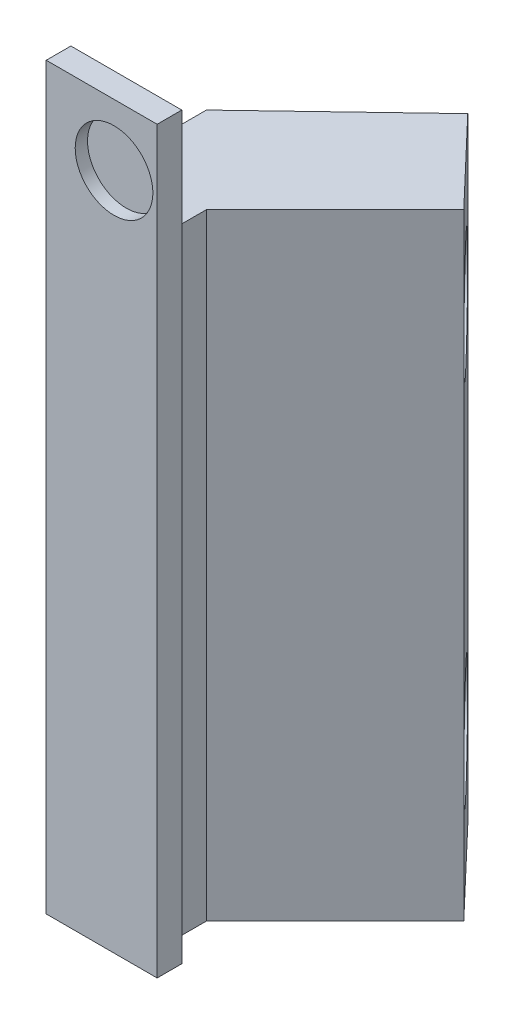
from build123d import *

# Parameters (mm, degrees)
BOSS_EXTRUDE1_DEPTH = 50
BOSS_EXTRUDE2_DEPTH = 10
SKETCH3_R           = 3.15
CUT_EXTRUDE1_DEPTH  = 1
BOSS_EXTRUDE3_DEPTH = 50
SKETCH5_W           = 5
SKETCH5_H           = 2
BOSS_EXTRUDE4_DEPTH = 1
SKETCH6_R           = 2.5
CUT_EXTRUDE2_DEPTH  = 65.756388779
SKETCH6_3_R         = 4.5
SKETCH6_3_R_2       = 2.5
CUT_EXTRUDE3_DEPTH  = 1


with BuildPart() as part:
    # Sketch1 → Boss-Extrude1 (new body)
    with BuildSketch(Plane(origin=(0, 0, 0), x_dir=(1, 0, 0), z_dir=(0, 1, 0))):
        Polygon((0, 0), (0, -6), (9, -6), (9, -4), (2, -4), (2, -2), (7, -2), (7, 0), align=None)
    extrude(amount=BOSS_EXTRUDE1_DEPTH)

    # Sketch2 → Boss-Extrude2 (add)
    with BuildSketch(Plane(origin=(0, 50, 0), x_dir=(1, 0, 0), z_dir=(0, 1, 0))):
        Polygon((2, -4), (0, -4), (0, -6), (9, -6), (9, -4), align=None)
    extrude(amount=BOSS_EXTRUDE2_DEPTH)

    # Sketch3 → Cut-Extrude1 (cut)
    with BuildSketch(Plane(origin=(0, 0, 6), x_dir=(-1, 0, 0), z_dir=(0, 0, -1))):
        with Locations((-5.5, 55)):
            Circle(SKETCH3_R)
    extrude(amount=CUT_EXTRUDE1_DEPTH, mode=Mode.SUBTRACT)

    # Sketch4 → Boss-Extrude3 (add)
    with BuildSketch(Plane.XZ):
        Polygon((0, -7), (10.857923623, -17.349178451), (17.441727636, -10.441727636), (7, 0), (0, 0), align=None)
    extrude(amount=-BOSS_EXTRUDE3_DEPTH)

    # Sketch5 → Boss-Extrude4 (add)
    with BuildSketch(Plane.XZ):
        with Locations((4.5, 3)):
            Rectangle(SKETCH5_W, SKETCH5_H)
    extrude(amount=-BOSS_EXTRUDE4_DEPTH)

    # Sketch6 → Cut-Extrude2 (cut, through all)
    with BuildSketch(Plane(origin=(14.353897508, 0, -13.681349394), x_dir=(-0.689945230056116, 0, -0.7238615748351431), z_dir=(0.7238615748351431, 0, -0.689945230056116))):
        with Locations((0.295779824, 40)):
            Circle(SKETCH6_R)
        with Locations((0.295779824, 10)):
            Circle(SKETCH6_R)
    extrude(amount=-CUT_EXTRUDE2_DEPTH, mode=Mode.SUBTRACT)

    # Sketch6<3> → Cut-Extrude3 (cut)
    # profile 1 of 2: a face of its own
    with BuildSketch(Plane(origin=(14.353897508, 0, -13.681349394), x_dir=(-0.689945230056116, 0, -0.7238615748351431), z_dir=(0.7238615748351431, 0, -0.689945230056116))):
        with Locations((0.295779824, 40)):
            Circle(SKETCH6_3_R)
        with Locations((0.295779824, 40)):
            Circle(SKETCH6_3_R_2, mode=Mode.SUBTRACT)
    # profile 2 of 2: a face of its own
    with BuildSketch(Plane(origin=(14.353897508, 0, -13.681349394), x_dir=(-0.689945230056116, 0, -0.7238615748351431), z_dir=(0.7238615748351431, 0, -0.689945230056116))):
        with Locations((0.295779824, 10)):
            Circle(SKETCH6_3_R)
        with Locations((0.295779824, 10)):
            Circle(SKETCH6_3_R_2, mode=Mode.SUBTRACT)
    extrude(amount=-CUT_EXTRUDE3_DEPTH, mode=Mode.SUBTRACT)


solid = part.part
